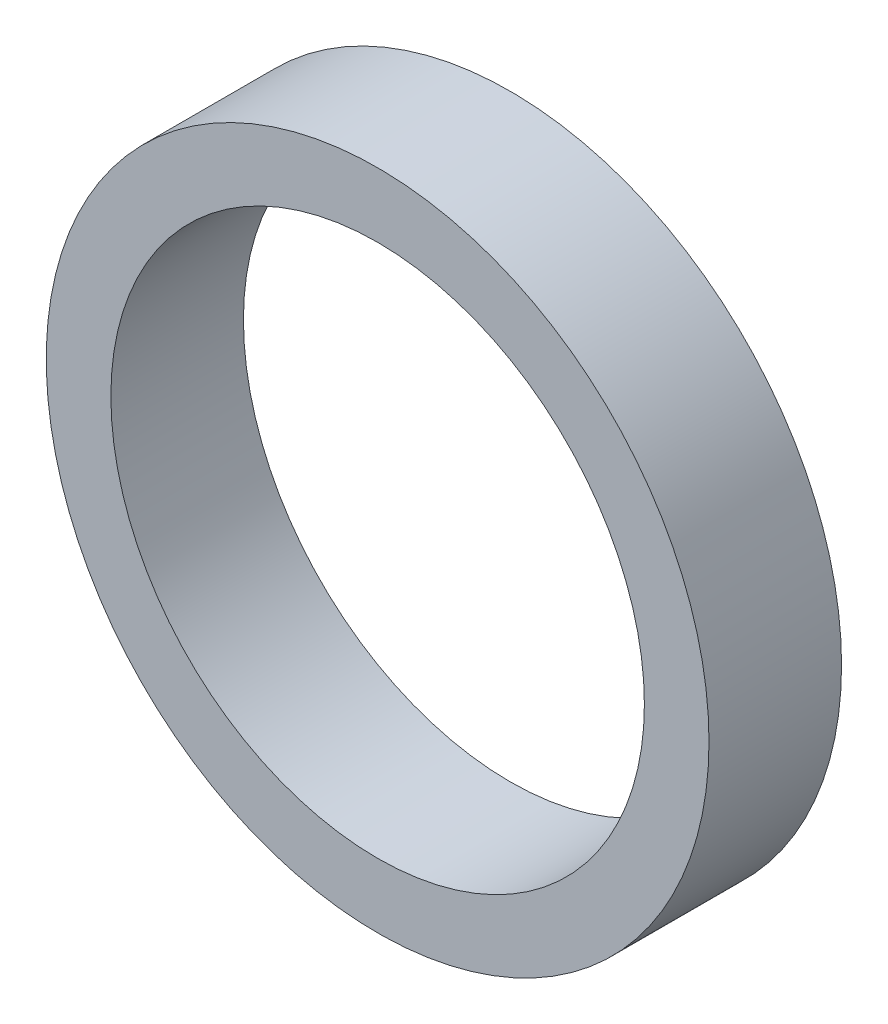
from build123d import *

# Parameters (mm, degrees)
SKETCH1_R           = 5
SKETCH1_R_2         = 4.025
BOSS_EXTRUDE1_DEPTH = 2


with BuildPart() as part:
    # Sketch1 → Boss-Extrude1 (new body)
    with BuildSketch(Plane.XY):
        Circle(SKETCH1_R)
        Circle(SKETCH1_R_2, mode=Mode.SUBTRACT)
    extrude(amount=BOSS_EXTRUDE1_DEPTH)


solid = part.part
